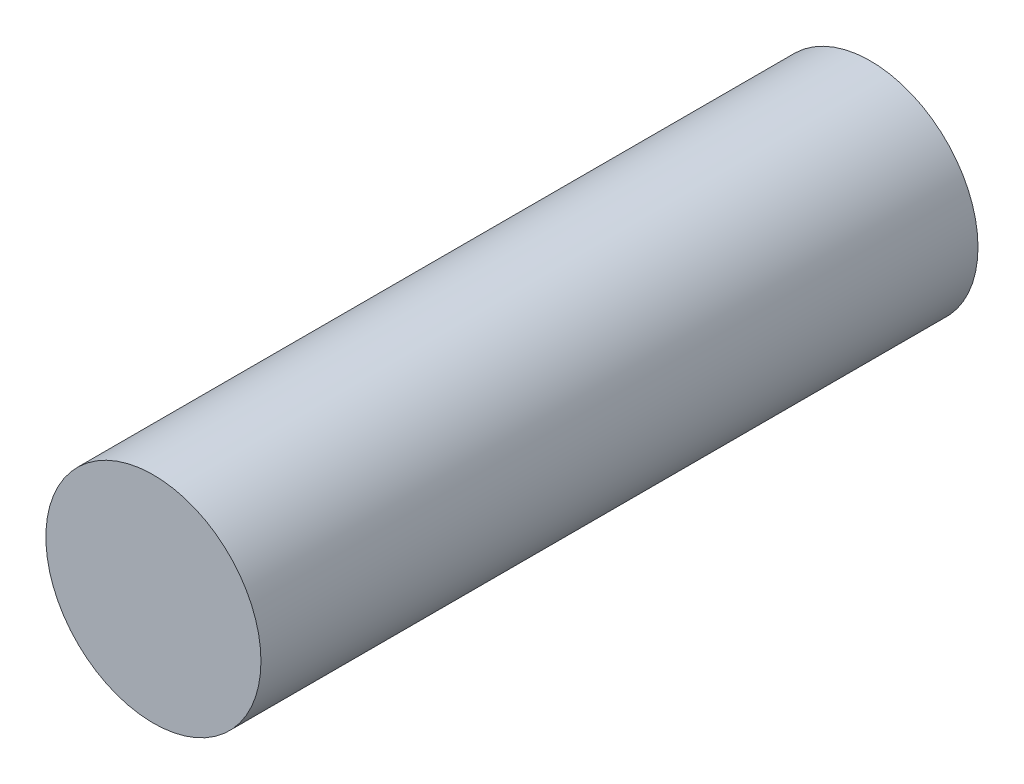
from build123d import *

# Parameters (mm, degrees)
KAPYAG_SAMANDIRA_D30_START = -300
SKETCH1_R                  = 15
KAPYAG_SAMANDIRA_D30_DEPTH = 100


with BuildPart() as part:
    # Sketch1 → KAPYAG_samandira_D30 (new body)
    with BuildSketch(Plane.XY.offset(KAPYAG_SAMANDIRA_D30_START)):
        with Locations((0, 140)):
            Circle(SKETCH1_R)
    extrude(amount=-KAPYAG_SAMANDIRA_D30_DEPTH)


solid = part.part
